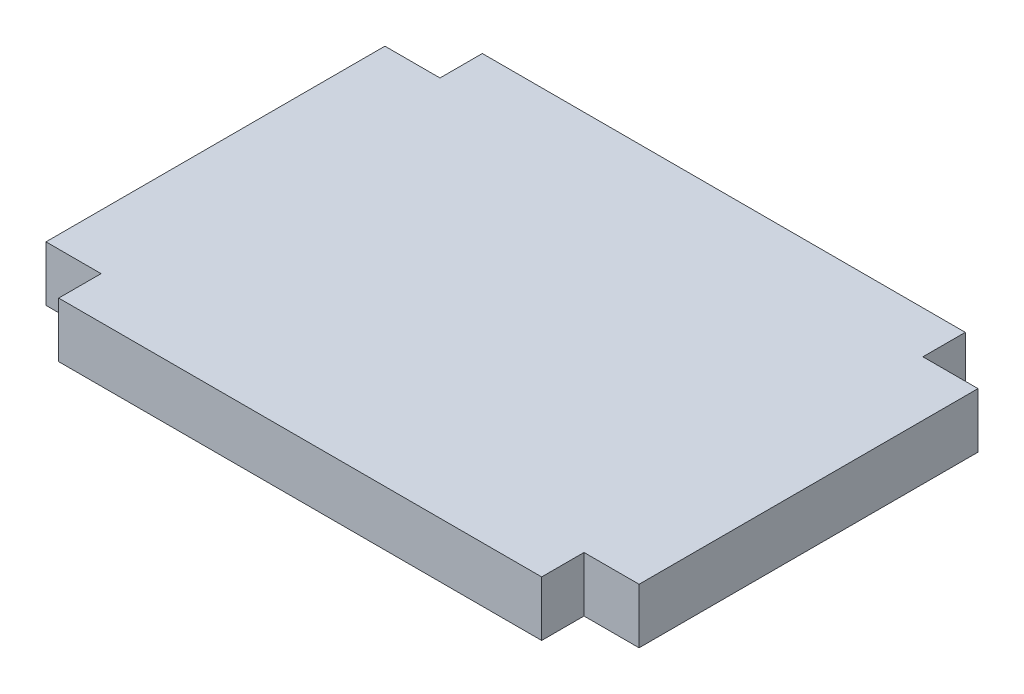
from build123d import *

# Parameters (mm, degrees)
SKETCH1_W           = 11.4
SKETCH1_H           = 10
BOSS_EXTRUDE1_DEPTH = 1.3
SKETCH2_W           = 1.3
SKETCH2_H           = 8
BOSS_EXTRUDE2_DEPTH = 1.3


with BuildPart() as part:
    # Sketch1 → Boss-Extrude1 (new body)
    with BuildSketch(Plane(origin=(0, 0, 0), x_dir=(1, 0, 0), z_dir=(0, 1, 0))):
        Rectangle(SKETCH1_W, SKETCH1_H)
    extrude(amount=BOSS_EXTRUDE1_DEPTH)

    # Sketch2 → Boss-Extrude2 (add)
    with BuildSketch(Plane(origin=(0, 1.3, 0), x_dir=(1, 0, 0), z_dir=(0, 1, 0))):
        with Locations((-6.35, 0)):
            Rectangle(SKETCH2_W, SKETCH2_H)
        with Locations((6.35, 0)):
            Rectangle(SKETCH2_W, SKETCH2_H)
    extrude(amount=-BOSS_EXTRUDE2_DEPTH)


solid = part.part
